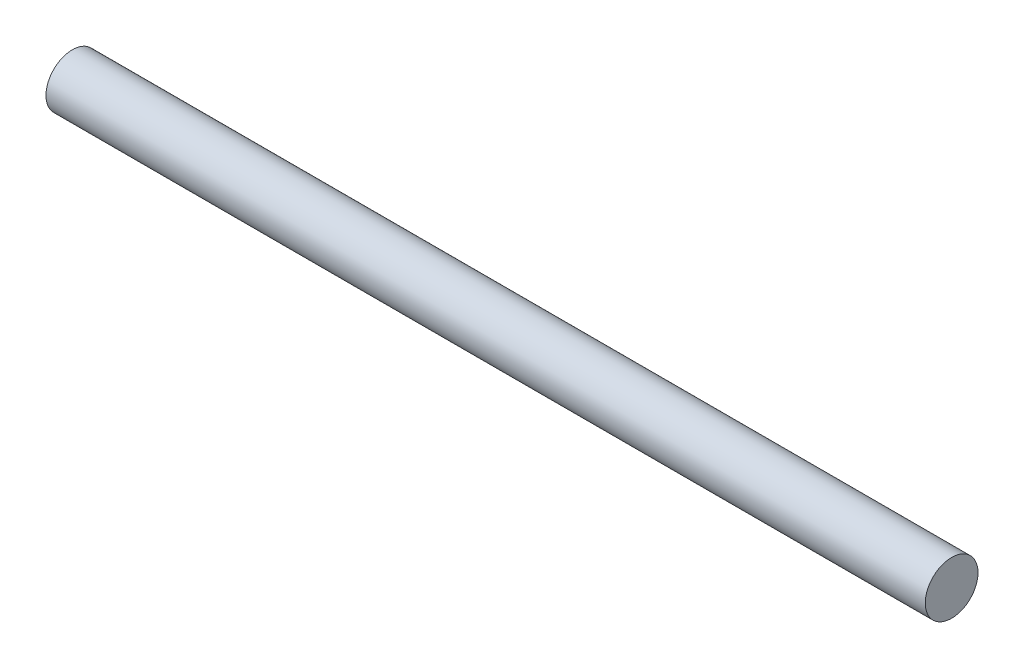
from build123d import *

# Parameters (mm, degrees)
SKETCH_1_R      = 0.3
EXTRUDE_1_DEPTH = 10


with BuildPart() as part:
    # Эскиз1 → Бобышка-Вытянуть1 (new body)
    with BuildSketch(Plane(origin=(0, 0, 0), x_dir=(0, 0, -1), z_dir=(1, 0, 0))):
        Circle(SKETCH_1_R)
    extrude(amount=EXTRUDE_1_DEPTH)


solid = part.part
